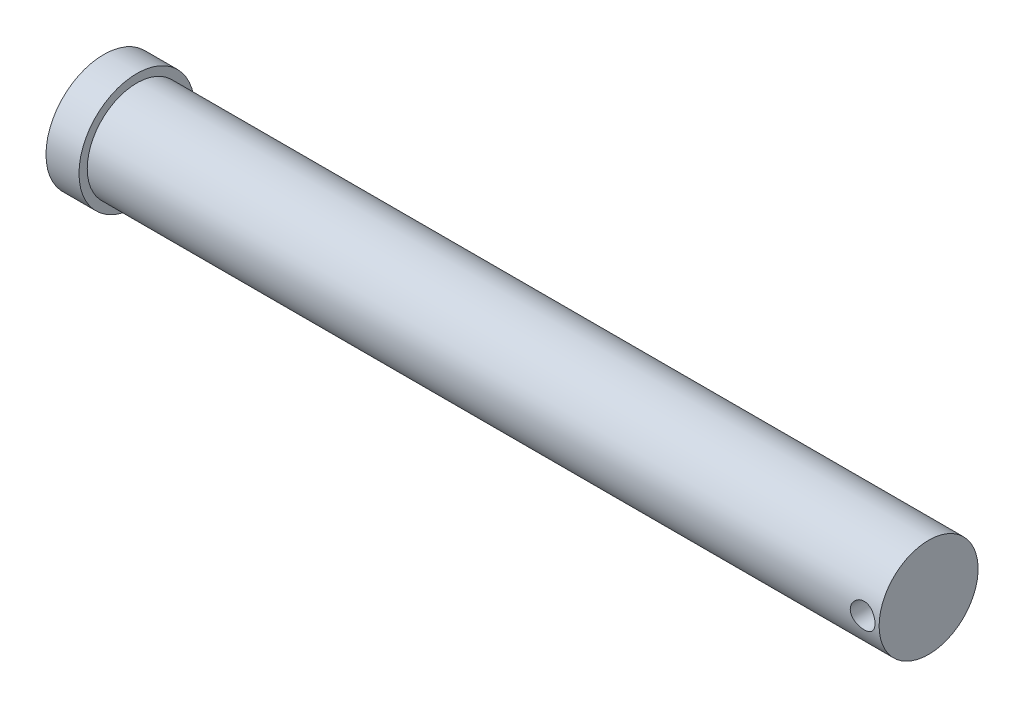
from build123d import *

# Parameters (mm, degrees)
IZIM2_R               = 7.5
KES_EKSTR_ZYON1_DEPTH = 30


with BuildPart() as part:
    # Çizim1 → Döndür1 (revolve)
    with BuildSketch(Plane.XY, mode=Mode.PRIVATE) as d_nd_r1_sk:
        Polygon((0, 0), (0, 35), (20, 35), (20, 30), (500, 30), (500, 0), align=None)
    revolve(d_nd_r1_sk.sketch.rotate(Axis((0, 0, 0), (1, 0, 0)), 90), axis=Axis((0, 0, 0), (1, 0, 0)))

    # Çizim2 → Kes-Ekstrüzyon1 (cut, symmetric)
    with BuildSketch(Plane.XY):
        with Locations((490, 0)):
            Circle(IZIM2_R)
    extrude(amount=KES_EKSTR_ZYON1_DEPTH, both=True, mode=Mode.SUBTRACT)


solid = part.part
